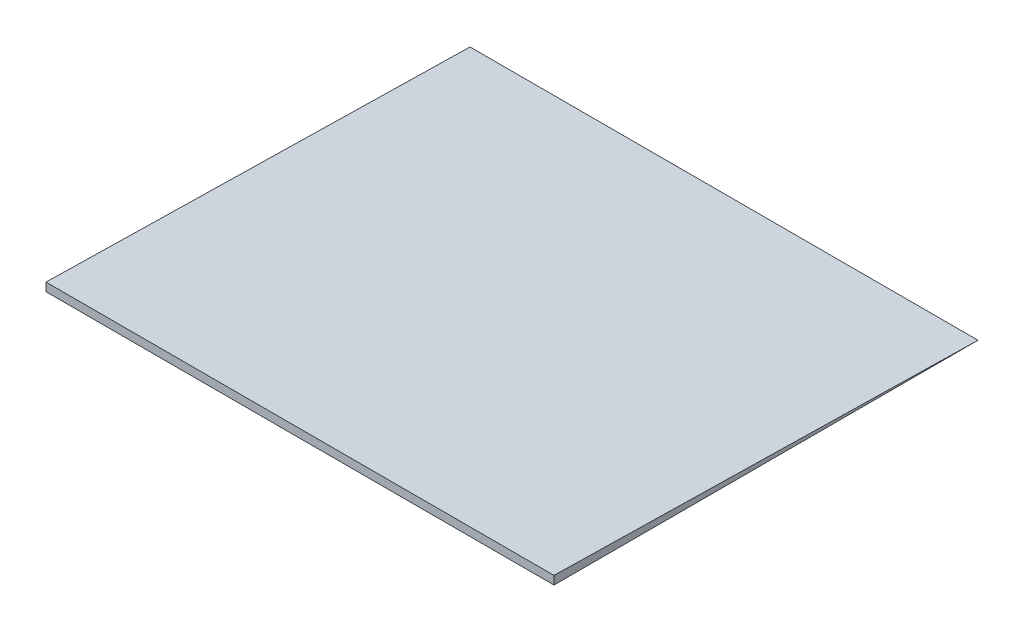
from build123d import *

# Parameters (mm, degrees)
SKETCH1_W           = 182
SKETCH1_H           = 151.91
BOSS_EXTRUDE1_DEPTH = 3
CUT_EXTRUDE1_DEPTH  = 198.236310108


with BuildPart() as part:
    # Sketch1 → Boss-Extrude1 (new body)
    with BuildSketch(Plane(origin=(0, 0, 0), x_dir=(1, 0, 0), z_dir=(0, 1, 0))):
        Rectangle(SKETCH1_W, SKETCH1_H)
    extrude(amount=BOSS_EXTRUDE1_DEPTH)

    # Sketch2 → Cut-Extrude1 (cut, through all)
    with BuildSketch(Plane(origin=(91, 0, 0), x_dir=(0, 0, -1), z_dir=(1, 0, 0))):
        Polygon((-75.955, 3), (75.955, 3), (75.955, 0), align=None)
    extrude(amount=-CUT_EXTRUDE1_DEPTH, mode=Mode.SUBTRACT)


solid = part.part
